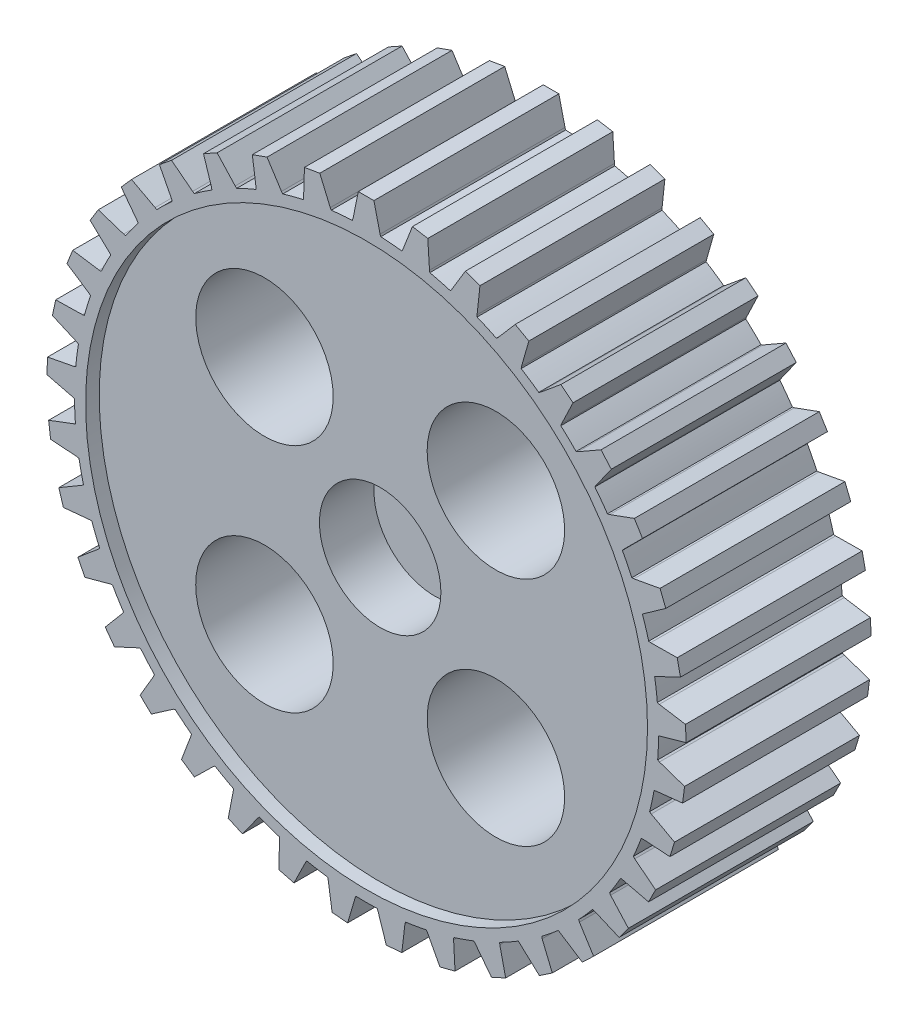
from build123d import *

# Parameters (mm, degrees)
BOSS_EXTRUDE1_DEPTH = 95
SKETCH2_R           = 144.323569377
CUT_EXTRUDE1_DEPTH  = 7
SKETCH3_R           = 35.308885546
CUT_EXTRUDE2_DEPTH  = 547
SKETCH4_R           = 25.12703578
BOSS_EXTRUDE2_DEPTH = 31
SKETCH5_R           = 141.944208509
CUT_EXTRUDE3_DEPTH  = 7
SKETCH7_R           = 30.765602042
CUT_EXTRUDE4_DEPTH  = 28
SKETCH8_R           = 31.191628947
CUT_EXTRUDE5_DEPTH  = 28


with BuildPart() as part:
    # Sketch1 → Boss-Extrude1 (new body)
    with BuildSketch(Plane.XY):
        with BuildLine():
            Line((-6.949723657, 150.793361114), (-4.221388732, 164.14841947))
            Line((-4.221388732, 164.14841947), (3.778611268, 164.14841947))
            Line((3.778611268, 164.14841947), (6.949723657, 150.793361114))
            Line((6.949723657, 150.793361114), (7.281636277, 149.823154997))
            ThreePointArc((7.281636277, 149.823154997), (12.706919915, 149.46081154), (18.115506664, 148.902076608))
            Line((18.115506664, 148.902076608), (18.634443518, 149.798844888))
            Line((18.634443518, 149.798844888), (23.580549647, 162.500712047))
            Line((23.580549647, 162.500712047), (31.46547693, 161.148705485))
            Line((31.46547693, 161.148705485), (32.333959937, 147.44982689))
            Line((32.333959937, 147.44982689), (32.497132665, 146.437482799))
            ThreePointArc((32.497132665, 146.437482799), (37.783142196, 145.163473938), (43.019504686, 143.698720302))
            Line((43.019504686, 143.698720302), (43.682531681, 144.494888633))
            Line((43.682531681, 144.494888633), (50.704118546, 156.178155002))
            Line((50.704118546, 156.178155002), (58.247138109, 153.513036645))
            Line((58.247138109, 153.513036645), (56.788007059, 139.864429607))
            Line((56.788007059, 139.864429607), (56.777745714, 138.83907084))
            ThreePointArc((56.777745714, 138.83907084), (61.772412268, 136.690047489), (66.685909884, 134.361413445))
            Line((66.685909884, 134.361413445), (67.47395294, 135.034077512))
            Line((67.47395294, 135.034077512), (76.369022271, 145.362636791))
            Line((76.369022271, 145.362636791), (83.353135176, 141.461077241))
            Line((83.353135176, 141.461077241), (79.608366612, 128.255387335))
            Line((79.608366612, 128.255387335), (79.424966394, 127.246511596))
            ThreePointArc((79.424966394, 127.246511596), (83.984602507, 124.284297245), (88.43388287, 121.158773354))
            Line((88.43388287, 121.158773354), (89.324271423, 121.688581838))
            Line((89.324271423, 121.688581838), (99.836928269, 130.365300181))
            Line((99.836928269, 130.365300181), (106.061214304, 125.339540202))
            Line((106.061214304, 125.339540202), (100.138538399, 112.956671083))
            Line((100.138538399, 112.956671083), (99.7872754, 111.99330189))
            ThreePointArc((99.7872754, 111.99330189), (103.780708643, 108.303114053), (107.637774056, 104.470615946))
            Line((107.637774056, 104.470615946), (108.604893249, 104.842327222))
            Line((108.604893249, 104.842327222), (120.432707615, 111.617591239))
            Line((120.432707615, 111.617591239), (125.718105402, 105.612212797))
            Line((125.718105402, 105.612212797), (117.787906759, 94.408397064))
            Line((117.787906759, 94.408397064), (117.278886174, 93.518248795))
            ThreePointArc((117.278886174, 93.518248795), (120.591232744, 89.206247457), (123.745122459, 84.777029127))
            Line((123.745122459, 84.777029127), (124.761150033, 84.979949738))
            Line((124.761150033, 84.979949738), (137.563857233, 89.65884742))
            Line((137.563857233, 89.65884742), (141.758315502, 82.846614318))
            Line((141.758315502, 82.846614318), (132.048731498, 73.144165351))
            Line((132.048731498, 73.144165351), (131.396596923, 72.35284595))
            ThreePointArc((131.396596923, 72.35284595), (133.932566639, 67.543079538), (136.29254899, 62.644561534))
            Line((136.29254899, 62.644561534), (137.328255682, 62.672853822))
            Line((137.328255682, 62.672853822), (150.737545141, 65.120781801))
            Line((150.737545141, 65.120781801), (153.720396963, 57.697669583))
            Line((153.720396963, 57.697669583), (142.510754651, 49.775709173))
            Line((142.510754651, 49.775709173), (141.734266811, 49.10598346))
            ThreePointArc((141.734266811, 49.10598346), (143.420904442, 43.936820197), (144.919087035, 38.709923961))
            Line((144.919087035, 38.709923961), (145.944677449, 38.56277401))
            Line((145.944677449, 38.56277401), (159.574788322, 38.709309856))
            Line((159.574788322, 38.709309856), (161.260222482, 30.888867944))
            Line((161.260222482, 30.888867944), (148.873002862, 24.975296469))
            Line((148.873002862, 24.975296469), (147.994499898, 24.446431233))
            ThreePointArc((147.994499898, 24.446431233), (148.78328395, 19.066578534), (149.376566798, 13.661672355))
            Line((149.376566798, 13.661672355), (150.362536566, 13.343313401))
            Line((150.362536566, 13.343313401), (163.82135538, 11.184241543))
            Line((163.82135538, 11.184241543), (164.160885006, 3.191449813))
            Line((164.160885006, 3.191449813), (150.952445834, -0.543610042))
            Line((150.952445834, -0.543610042), (149.997200675, -0.916400312))
            ThreePointArc((149.997200675, -0.916400312), (149.865439268, -6.352173879), (149.536754705, -11.77960069))
            Line((149.536754705, -11.77960069), (150.45473927, -12.26001004))
            Line((150.45473927, -12.26001004), (163.355080313, -16.662577035))
            Line((163.355080313, -16.662577035), (162.338937755, -24.597780517))
            Line((162.338937755, -24.597780517), (148.689261776, -26.046877882))
            Line((148.689261776, -26.046877882), (147.684755089, -26.252868687))
            ThreePointArc((147.684755089, -26.252868687), (146.636238758, -31.588185814), (145.395042439, -36.881996071))
            Line((145.395042439, -36.881996071), (146.218633058, -37.510635315))
            Line((146.218633058, -37.510635315), (158.189377005, -44.03004361))
            Line((158.189377005, -44.03004361), (155.846794835, -51.679377488))
            Line((155.846794835, -51.679377488), (142.148558376, -50.800824468))
            Line((142.148558376, -50.800824468), (141.123687987, -50.83408983))
            ThreePointArc((141.123687987, -50.83408983), (139.188580638, -55.915463156), (137.070579522, -60.923363576))
            Line((137.070579522, -60.923363576), (137.776082992, -61.682147906))
            Line((137.776082992, -61.682147906), (148.472853335, -70.130845995))
            Line((148.472853335, -70.130845995), (144.871223376, -77.274252861))
            Line((144.871223376, -77.274252861), (131.51849976, -74.093323828))
            Line((131.51849976, -74.093323828), (130.502749326, -73.952906761))
            ThreePointArc((130.502749326, -73.952906761), (127.736720473, -78.634154429), (124.802845597, -83.212076834))
            Line((124.802845597, -83.212076834), (125.369965867, -84.079177407))
            Line((125.369965867, -84.079177407), (134.485035999, -94.214111628))
            Line((134.485035999, -94.214111628), (129.727970588, -100.646088671))
            Line((129.727970588, -100.646088671), (117.104893361, -95.254293162))
            Line((117.104893361, -95.254293162), (116.127484172, -94.94423321))
            ThreePointArc((116.127484172, -94.94423321), (112.61010743, -99.090684247), (108.944761031, -103.106930145))
            Line((108.944761031, -103.106930145), (109.357183084, -104.057402057))
            Line((109.357183084, -104.057402057), (116.628329033, -115.587008805))
            Line((116.628329033, -115.587008805), (110.852680281, -121.122519757))
            Line((110.852680281, -121.122519757), (99.322392393, -113.674969911))
            Line((99.322392393, -113.674969911), (98.411442731, -113.204186935))
            ThreePointArc((98.411442731, -113.204186935), (94.243906625, -116.696555493), (89.952534046, -120.035584802))
            Line((89.952534046, -120.035584802), (90.198393251, -121.042084706))
            Line((90.198393251, -121.042084706), (95.416437385, -133.634678187))
            Line((95.416437385, -133.634678187), (88.788360191, -138.114476476))
            Line((88.788360191, -138.114476476), (78.682567031, -128.825424744))
            Line((78.682567031, -128.825424744), (77.86428326, -128.207462312))
            ThreePointArc((77.86428326, -128.207462312), (73.166480216, -130.945279307), (68.372536432, -133.511034232))
            Line((68.372536432, -133.511034232), (68.444759867, -134.544606959))
            Line((68.444759867, -134.544606959), (71.459588559, -147.837921186))
            Line((71.459588559, -147.837921186), (64.169760636, -151.133131172))
            Line((64.169760636, -151.133131172), (55.779187473, -140.269806658))
            Line((55.779187473, -140.269806658), (55.077110127, -139.522442424))
            ThreePointArc((55.077110127, -139.522442424), (49.984187385, -141.426945846), (44.825585431, -143.145614291))
            Line((44.825585431, -143.145614291), (44.722095359, -144.176525835))
            Line((44.722095359, -144.176525835), (45.446977475, -157.78813636))
            Line((45.446977475, -157.78813636), (37.7051139, -159.803960851))
            Line((37.7051139, -159.803960851), (31.271142248, -147.678881623))
            Line((31.271142248, -147.678881623), (30.705468814, -146.823615896))
            ThreePointArc((30.705468814, -146.823615896), (25.363940489, -147.840016649), (19.989083951, -148.662155651))
            Line((19.989083951, -148.662155651), (19.712857592, -149.660748563))
            Line((19.712857592, -149.660748563), (18.126939595, -163.199074135))
            Line((18.126939595, -163.199074135), (10.155759687, -163.87752153))
            Line((10.155759687, -163.87752153), (5.863483196, -150.839504043))
            Line((5.863483196, -150.839504043), (5.450487069, -149.90094126))
            ThreePointArc((5.450487069, -149.90094126), (0.014019205, -149.999999345), (-5.42246708, -149.901957461))
            Line((-5.42246708, -149.901957461), (-5.863483196, -150.839504043))
            Line((-5.863483196, -150.839504043), (-9.714577334, -163.915071683))
            Line((-9.714577334, -163.915071683), (-17.685757242, -163.236624287))
            Line((-17.685757242, -163.236624287), (-19.712857592, -149.660748563))
            Line((-19.712857592, -149.660748563), (-19.961295266, -148.665889468))
            ThreePointArc((-19.961295266, -148.665889468), (-25.336305386, -147.844755164), (-30.678023607, -146.829352881))
            Line((-30.678023607, -146.829352881), (-31.271142248, -147.678881623))
            Line((-31.271142248, -147.678881623), (-37.27662356, -159.915531058))
            Line((-37.27662356, -159.915531058), (-45.018487135, -157.899706567))
            Line((-45.018487135, -157.899706567), (-44.722095359, -144.176525835))
            Line((-44.722095359, -144.176525835), (-44.798827479, -143.153990711))
            ThreePointArc((-44.798827479, -143.153990711), (-49.957750601, -141.436286556), (-55.051029249, -139.532735151))
            Line((-55.051029249, -139.532735151), (-55.779187473, -140.269806658))
            Line((-55.779187473, -140.269806658), (-63.766289196, -151.315511762))
            Line((-63.766289196, -151.315511762), (-71.056117119, -148.020301776))
            Line((-71.056117119, -148.020301776), (-68.444759867, -134.544606959))
            Line((-68.444759867, -134.544606959), (-68.347578991, -133.523812281))
            ThreePointArc((-68.347578991, -133.523812281), (-73.142002289, -130.958953498), (-77.840317011, -128.222014676))
            Line((-77.840317011, -128.222014676), (-78.682567031, -128.825424744))
            Line((-78.682567031, -128.825424744), (-88.42151479, -138.362420692))
            Line((-88.42151479, -138.362420692), (-95.049591984, -133.882622403))
            Line((-95.049591984, -133.882622403), (-90.198393251, -121.042084706))
            Line((-90.198393251, -121.042084706), (-89.930095095, -120.052396878))
            ThreePointArc((-89.930095095, -120.052396878), (-94.22209174, -116.714169783), (-98.390280576, -113.222580293))
            Line((-98.390280576, -113.222580293), (-99.322392393, -113.674969911))
            Line((-99.322392393, -113.674969911), (-110.533014393, -121.428894694))
            Line((-110.533014393, -121.428894694), (-116.308663144, -115.893383743))
            Line((-116.308663144, -115.893383743), (-109.357183084, -104.057402057))
            Line((-109.357183084, -104.057402057), (-108.925486099, -103.127292596))
            ThreePointArc((-108.925486099, -103.127292596), (-112.591583162, -99.111731905), (-116.109734908, -94.965938418))
            Line((-116.109734908, -94.965938418), (-117.104893361, -95.254293162))
            Line((-117.104893361, -95.254293162), (-129.464680418, -101.002080482))
            Line((-129.464680418, -101.002080482), (-134.221745829, -94.570103439))
            Line((-134.221745829, -94.570103439), (-125.369965867, -84.079177407))
            Line((-125.369965867, -84.079177407), (-124.787289188, -83.235403869))
            ThreePointArc((-124.787289188, -83.235403869), (-127.722019731, -78.658029952), (-130.488923567, -73.977299399))
            Line((-130.488923567, -73.977299399), (-131.51849976, -74.093323828))
            Line((-131.51849976, -74.093323828), (-144.671883304, -77.669620308))
            Line((-144.671883304, -77.669620308), (-148.273513263, -70.526213442))
            Line((-148.273513263, -70.526213442), (-137.776082992, -61.682147906))
            Line((-137.776082992, -61.682147906), (-137.059189166, -60.948984119))
            ThreePointArc((-137.059189166, -60.948984119), (-139.178126335, -55.941479689), (-141.114183475, -50.860468167))
            Line((-141.114183475, -50.860468167), (-142.148558376, -50.800824468))
            Line((-142.148558376, -50.800824468), (-155.717139511, -52.10274657))
            Line((-155.717139511, -52.10274657), (-158.059721681, -44.453412692))
            Line((-158.059721681, -44.453412692), (-146.218633058, -37.510635315))
            Line((-146.218633058, -37.510635315), (-145.388145815, -36.909173065))
            ThreePointArc((-145.388145815, -36.909173065), (-146.630331646, -31.615594909), (-147.679845251, -26.280473866))
            Line((-147.679845251, -26.280473866), (-148.689261776, -26.046877882))
            Line((-148.689261776, -26.046877882), (-162.282697127, -25.036971677))
            Line((-162.282697127, -25.036971677), (-163.298839685, -17.101768195))
            Line((-163.298839685, -17.101768195), (-150.45473927, -12.26001004))
            Line((-150.45473927, -12.26001004), (-149.534550217, -11.807552303))
            ThreePointArc((-149.534550217, -11.807552303), (-149.864249284, -6.380187025), (-149.997026759, -0.944438182))
            Line((-149.997026759, -0.944438182), (-150.952445834, -0.543610042))
            Line((-150.952445834, -0.543610042), (-164.179677014, 2.749071307))
            Line((-164.179677014, 2.749071307), (-163.840147388, 10.741863037))
            Line((-163.840147388, 10.741863037), (-150.362536566, 13.343313401))
            Line((-150.362536566, 13.343313401), (-149.379117866, 13.633750241))
            ThreePointArc((-149.379117866, 13.633750241), (-148.786845328, 19.038767223), (-147.999066906, 24.41876727))
            Line((-147.999066906, 24.41876727), (-148.873002862, 24.975296469))
            Line((-148.873002862, 24.975296469), (-161.353506515, 30.456028514))
            Line((-161.353506515, 30.456028514), (-159.668072355, 38.276470426))
            Line((-159.668072355, 38.276470426), (-145.944677449, 38.56277401))
            Line((-145.944677449, 38.56277401), (-144.926320267, 38.682834613))
            ThreePointArc((-144.926320267, 38.682834613), (-143.429114727, 43.910010802), (-141.743443359, 49.079489246))
            Line((-141.743443359, 49.079489246), (-142.510754651, 49.775709173))
            Line((-142.510754651, 49.775709173), (-153.885489409, 57.286821233))
            Line((-153.885489409, 57.286821233), (-150.902637586, 64.709933451))
            Line((-150.902637586, 64.709933451), (-137.328255682, 62.672853822))
            Line((-137.328255682, 62.672853822), (-136.304256302, 62.619084264))
            ThreePointArc((-136.304256302, 62.619084264), (-133.945189636, 67.518043317), (-131.410119019, 72.328283676))
            Line((-131.410119019, 72.328283676), (-132.048731498, 73.144165351))
            Line((-132.048731498, 73.144165351), (-141.990466951, 82.469576406))
            Line((-141.990466951, 82.469576406), (-137.796008682, 89.281809508))
            Line((-137.796008682, 89.281809508), (-124.761150033, 84.979949738))
            Line((-124.761150033, 84.979949738), (-123.760967051, 84.75389687))
            ThreePointArc((-123.760967051, 84.75389687), (-120.607905313, 89.183704656), (-117.296364812, 93.496325072))
            Line((-117.296364812, 93.496325072), (-117.787906759, 94.408397064))
            Line((-117.787906759, 94.408397064), (-126.01063728, 105.279832018))
            Line((-126.01063728, 105.279832018), (-120.725239493, 111.28521046))
            Line((-120.725239493, 111.28521046), (-108.604893249, 104.842327222))
            Line((-108.604893249, 104.842327222), (-107.657300109, 104.450494175))
            ThreePointArc((-107.657300109, 104.450494175), (-103.800951144, 108.283713187), (-99.80820775, 111.974647424))
            Line((-99.80820775, 111.974647424), (-100.138538399, 112.956671083))
            Line((-100.138538399, 112.956671083), (-106.405711002, 125.061378545))
            Line((-106.405711002, 125.061378545), (-100.181424968, 130.087138523))
            Line((-100.181424968, 130.087138523), (-89.324271423, 121.688581838))
            Line((-89.324271423, 121.688581838), (-88.456528654, 121.142240934))
            ThreePointArc((-88.456528654, 121.142240934), (-84.0078326, 124.268596443), (-79.448750272, 127.231663041))
            Line((-79.448750272, 127.231663041), (-79.608366612, 128.255387335))
            Line((-79.608366612, 128.255387335), (-83.739686151, 141.24513691))
            Line((-83.739686151, 141.24513691), (-76.755573246, 145.146696461))
            Line((-76.755573246, 145.146696461), (-67.47395294, 135.034077512))
            Line((-67.47395294, 135.034077512), (-66.711023922, 134.348945985))
            ThreePointArc((-66.711023922, 134.348945985), (-61.797961666, 136.678498433), (-56.803696901, 138.828455363))
            Line((-56.803696901, 138.828455363), (-56.788007059, 139.864429607))
            Line((-56.788007059, 139.864429607), (-58.664622994, 153.365529851))
            Line((-58.664622994, 153.365529851), (-51.12160343, 156.030648209))
            Line((-51.12160343, 156.030648209), (-43.682531681, 144.494888633))
            Line((-43.682531681, 144.494888633), (-43.046364492, 143.690676469))
            ThreePointArc((-43.046364492, 143.690676469), (-37.810275889, 145.156408874), (-32.524504592, 146.431405788))
            Line((-32.524504592, 146.431405788), (-32.333959937, 147.44982689))
            Line((-32.333959937, 147.44982689), (-31.901885443, 161.07387573))
            Line((-31.901885443, 161.07387573), (-24.01695816, 162.425882292))
            Line((-24.01695816, 162.425882292), (-18.634443518, 149.798844888))
            Line((-18.634443518, 149.798844888), (-18.14333953, 148.898687807))
            ThreePointArc((-18.14333953, 148.898687807), (-12.734857316, 149.458433717), (-7.309641503, 149.821791276))
            Line((-7.309641503, 149.821791276), (-6.949723657, 150.793361114))
        make_face()
    extrude(amount=BOSS_EXTRUDE1_DEPTH)

    # Sketch2 → Cut-Extrude1 (cut)
    with BuildSketch(Plane.XY.offset(95)):
        Circle(SKETCH2_R)
    extrude(amount=-CUT_EXTRUDE1_DEPTH, mode=Mode.SUBTRACT)

    # Sketch3 → Cut-Extrude2 (cut)
    with BuildSketch(Plane.XY.offset(88)):
        with Locations((-59.441667824, 59.441667824)):
            Circle(SKETCH3_R)
        with Locations((-59.441667824, -59.441667824)):
            Circle(SKETCH3_R)
        with Locations((59.441667824, -59.441667824)):
            Circle(SKETCH3_R)
        with Locations((59.441667824, 59.441667824)):
            Circle(SKETCH3_R)
    extrude(amount=-CUT_EXTRUDE2_DEPTH, mode=Mode.SUBTRACT)

    # Sketch4 → Boss-Extrude2 (add)
    with BuildSketch(Plane.XY.offset(88)):
        Circle(SKETCH4_R)
    extrude(amount=-BOSS_EXTRUDE2_DEPTH)

    # Sketch5 → Cut-Extrude3 (cut)
    with BuildSketch(Plane(origin=(0, 0, 0), x_dir=(-1, 0, 0), z_dir=(0, 0, -1))):
        Circle(SKETCH5_R)
    extrude(amount=-CUT_EXTRUDE3_DEPTH, mode=Mode.SUBTRACT)

    # Sketch7 → Cut-Extrude4 (cut)
    with BuildSketch(Plane(origin=(0, 0, 7), x_dir=(-1, 0, 0), z_dir=(0, 0, -1))):
        Circle(SKETCH7_R)
    extrude(amount=-CUT_EXTRUDE4_DEPTH, mode=Mode.SUBTRACT)

    # Sketch8 → Cut-Extrude5 (cut)
    with BuildSketch(Plane.XY.offset(88)):
        Circle(SKETCH8_R)
    extrude(amount=-CUT_EXTRUDE5_DEPTH, mode=Mode.SUBTRACT)


solid = part.part
